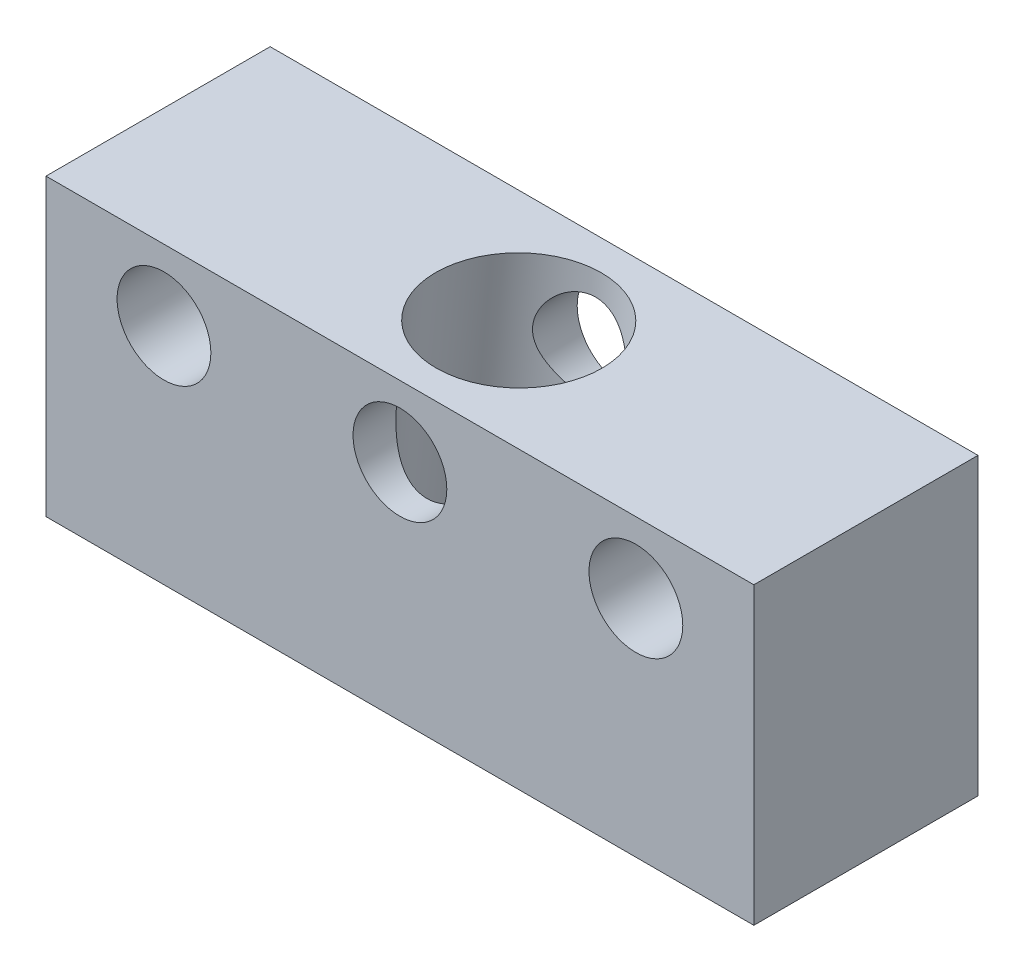
from build123d import *

# Parameters (mm, degrees)
ESQUISSE1_W          = 60
ESQUISSE1_H          = 25
ESQUISSE1_R          = 3.975
BASE_EXTRUSION_DEPTH = 19
ESQUISSE2_W          = 7
ESQUISSE2_H          = 34.447811935


with BuildPart() as part:
    # Esquisse1 → Base-Extrusion (new body)
    with BuildSketch(Plane.XY):
        with Locations((0, -6.5)):
            Rectangle(ESQUISSE1_W, ESQUISSE1_H)
        with Locations((-20, 0)):
            Circle(ESQUISSE1_R, mode=Mode.SUBTRACT)
        with Locations(Location((0, 0, 0), (0, 0, 180))):
            Circle(ESQUISSE1_R, mode=Mode.SUBTRACT)
        with Locations((20, 0)):
            Circle(ESQUISSE1_R, mode=Mode.SUBTRACT)
    extrude(amount=BASE_EXTRUSION_DEPTH)

    # Esquisse2 → Enlever de la matière-Révolution2 (revolve, cut)
    with BuildSketch(Plane(origin=(0, 0, 0), x_dir=(0, 0, -1), z_dir=(0.9945218953682731, -0.10452846326765709, 0)), mode=Mode.PRIVATE) as enlever_de_la_mati_re_r_volution2_sk:
        with Locations((-6.059329615, -6.776094032)):
            Rectangle(ESQUISSE2_W, ESQUISSE2_H)
    revolve(enlever_de_la_mati_re_r_volution2_sk.sketch.rotate(Axis((0.951521061, 9.053118164, 9.559329615), (-0.10452846326765709, -0.994521895368273, 0)), 90), axis=Axis((0.951521061, 9.053118164, 9.559329615), (-0.10452846326765709, -0.994521895368273, 0)), mode=Mode.SUBTRACT)


solid = part.part
